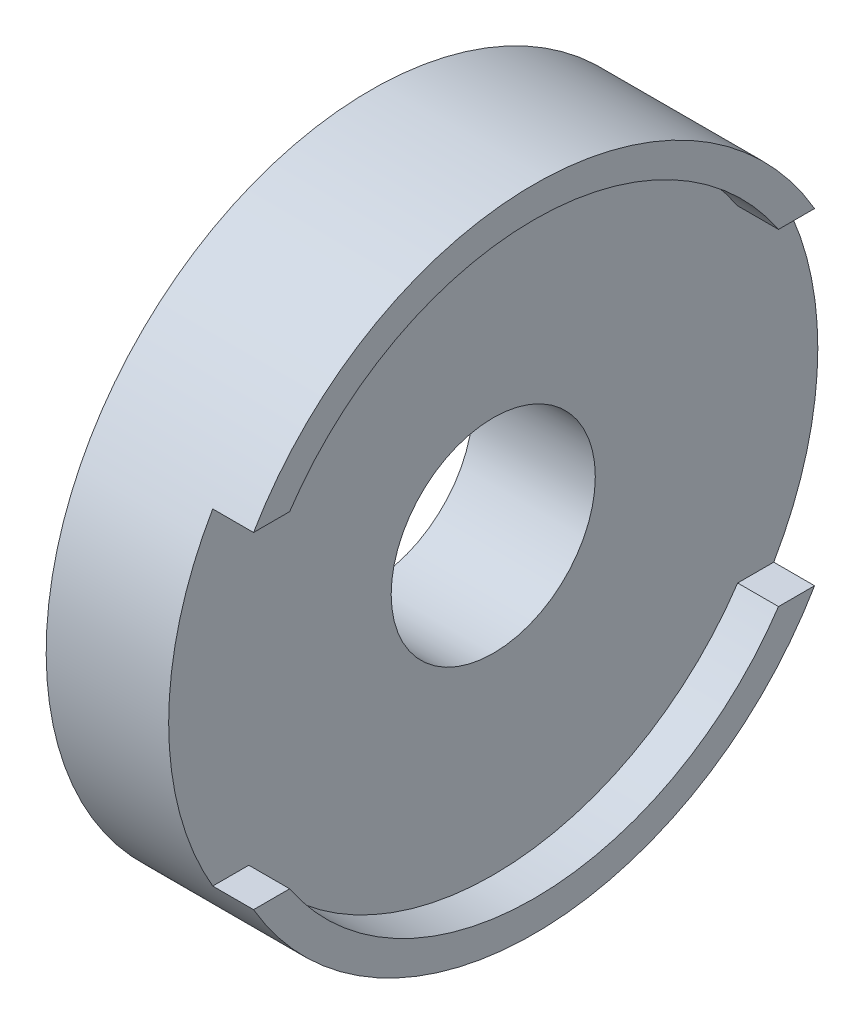
from build123d import *

# Parameters (mm, degrees)
SKETCH1_R           = 15.9
SKETCH1_R_2         = 5
BOSS_EXTRUDE1_DEPTH = 6
BOSS_EXTRUDE2_DEPTH = 2


with BuildPart() as part:
    # Sketch1 → Boss-Extrude1 (new body)
    with BuildSketch(Plane(origin=(0, 0, 0), x_dir=(0, 0, -1), z_dir=(1, 0, 0))):
        Circle(SKETCH1_R)
        Circle(SKETCH1_R_2, mode=Mode.SUBTRACT)
    extrude(amount=BOSS_EXTRUDE1_DEPTH)

    # Sketch2 → Boss-Extrude2 (add)
    with BuildSketch(Plane(origin=(6, 0, 0), x_dir=(0, 0, -1), z_dir=(1, 0, 0))):
        with BuildLine():
            Line((11.973303638, -8), (13.740815114, -8))
            ThreePointArc((13.740815114, -8), (0, -15.9), (-13.740815114, -8))
            Line((-13.740815114, -8), (-11.973303638, -8))
            ThreePointArc((-11.973303638, -8), (0, -14.4), (11.973303638, -8))
        make_face()
        with BuildLine():
            Line((-13.740815114, 8), (-11.973303638, 8))
            ThreePointArc((-11.973303638, 8), (0, 14.4), (11.973303638, 8))
            Line((11.973303638, 8), (13.740815114, 8))
            ThreePointArc((13.740815114, 8), (0, 15.9), (-13.740815114, 8))
        make_face()
    extrude(amount=BOSS_EXTRUDE2_DEPTH)


solid = part.part
